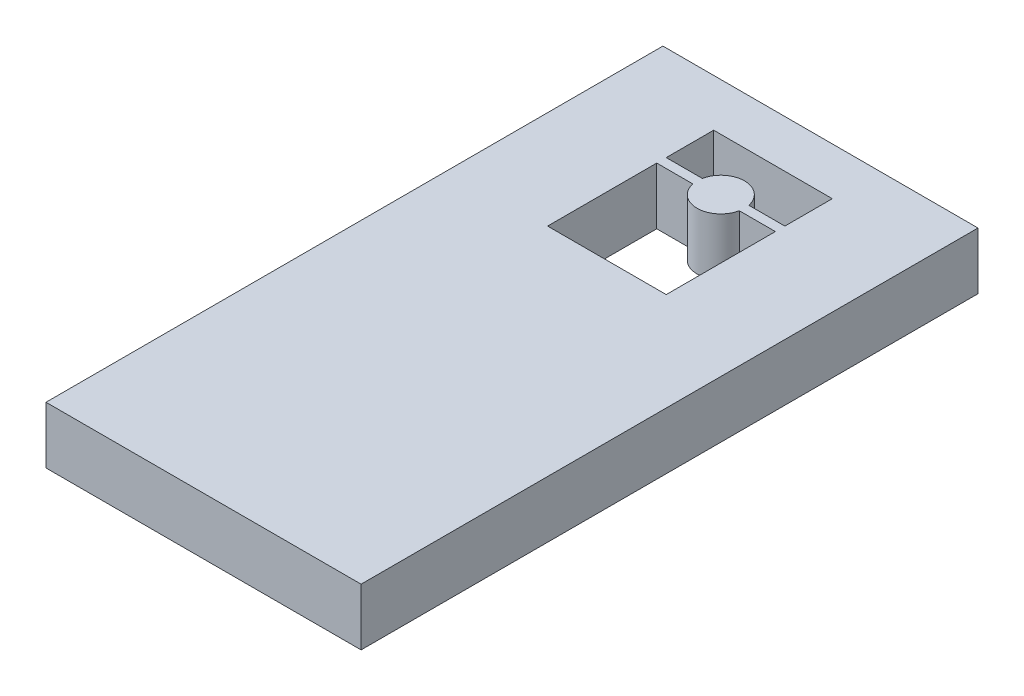
from build123d import *

# Parameters (mm, degrees)
SKETCH1_W           = 66.4
SKETCH1_H           = 130
BOSS_EXTRUDE1_DEPTH = 12
SKETCH2_W           = 25
SKETCH2_H           = 45
CUT_EXTRUDE2_DEPTH  = 20
SKETCH3_W           = 25
SKETCH3_H           = 10
BOSS_EXTRUDE2_DEPTH = 12
SKETCH4_R           = 5
BOSS_EXTRUDE4_DEPTH = 12
SKETCH5_W           = 25
SKETCH5_H           = 2
BOSS_EXTRUDE5_DEPTH = 12


with BuildPart() as part:
    # Sketch1 → Boss-Extrude1 (new body)
    with BuildSketch(Plane(origin=(0, 0, 0), x_dir=(1, 0, 0), z_dir=(0, 1, 0))):
        with Locations((33.2, 65)):
            Rectangle(SKETCH1_W, SKETCH1_H)
    extrude(amount=BOSS_EXTRUDE1_DEPTH)

    # Sketch2 → Cut-Extrude2 (cut)
    with BuildSketch(Plane(origin=(0, 12, 0), x_dir=(1, 0, 0), z_dir=(0, 1, 0))):
        with Locations((33.2, 107.5)):
            Rectangle(SKETCH2_W, SKETCH2_H)
    extrude(amount=-CUT_EXTRUDE2_DEPTH, mode=Mode.SUBTRACT)

    # Sketch3 → Boss-Extrude2 (add)
    with BuildSketch(Plane(origin=(0, 12, 0), x_dir=(1, 0, 0), z_dir=(0, 1, 0))):
        with Locations((33.2, 125)):
            Rectangle(SKETCH3_W, SKETCH3_H)
    extrude(amount=-BOSS_EXTRUDE2_DEPTH)



with BuildPart() as body_2:
    # Sketch4 → Boss-Extrude4 (new body)
    with BuildSketch(Plane(origin=(0, 12, 0), x_dir=(1, 0, 0), z_dir=(0, 1, 0))):
        with Locations(Location((33.2, 109, 0), (0, 0, 270))):
            Circle(SKETCH4_R)
    extrude(amount=-BOSS_EXTRUDE4_DEPTH)


with BuildPart() as part_1:
    add(part.part)

    add(body_2.part)  # Boss-Extrude5 merges body 2
    # Sketch5 → Boss-Extrude5 (add)
    with BuildSketch(Plane(origin=(0, 12, 0), x_dir=(1, 0, 0), z_dir=(0, 1, 0))):
        with Locations((33.2, 109)):
            Rectangle(SKETCH5_W, SKETCH5_H)
    extrude(amount=-BOSS_EXTRUDE5_DEPTH)


solid = part_1.part
